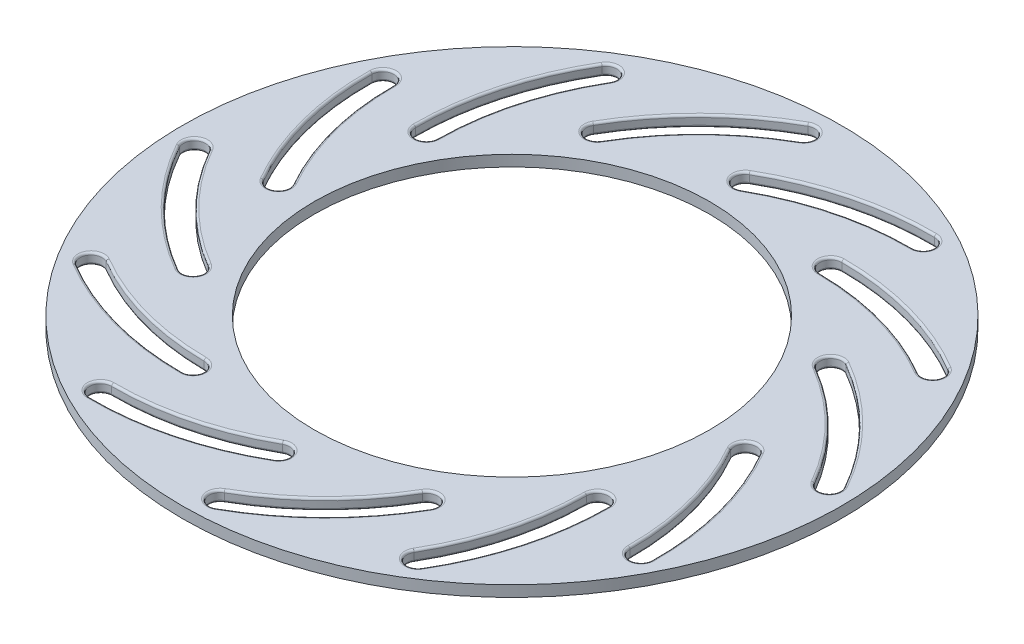
from build123d import *

# Parameters (mm, degrees)
SKETCH_01_R              = 60
SKETCH_01_R_2            = 36
TOP_RING_DEPTH           = 2
CUT_EXTRUDE1_DEPTH       = 85.876380696
FILLET1_R                = 0.4
CIRPATTERN1_COUNT        = 12
FILLET1_OF_CIRPATTERN1_R = 0.4


with BuildPart() as part:
    # sketch 01 → top ring (new body)
    with BuildSketch(Plane(origin=(0, 0, 0), x_dir=(1, 0, 0), z_dir=(0, 1, 0))):
        with Locations(Location((0, 0, 0), (0, 0, 270))):
            Circle(SKETCH_01_R)
        with Locations(Location((0, 0, 0), (0, 0, 270))):
            Circle(SKETCH_01_R_2, mode=Mode.SUBTRACT)
    extrude(amount=TOP_RING_DEPTH)

    # Sketch2 → Cut-Extrude1 (cut, through all)
    with BuildSketch(Plane(origin=(0, 2, 0), x_dir=(1, 0, 0), z_dir=(0, 1, 0))):
        with BuildLine():
            ThreePointArc((-1, 44.232050808), (11.890599802, 49.519139452), (25.722326885, 51.193712683))
            ThreePointArc((25.722326885, 51.193712683), (27.694418732, 49.171424871), (25.677365486, 47.193979435))
            ThreePointArc((25.677365486, 47.193979435), (12.908045968, 45.613674132), (0.990803619, 40.762672112))
            ThreePointArc((0.990803619, 40.762672112), (-1.734695442, 41.504594694), (-1, 44.232050808))
        make_face()
    cut_extrude1 = extrude(amount=-CUT_EXTRUDE1_DEPTH, mode=Mode.SUBTRACT)

    # Fillet1
    fillet1_edges = [part.edges().sort_by_distance(p)[0] for p in [
        (-1.734695442, 0, -41.504594694),
        (11.890599802, 2, -49.519139452),
        (27.694418732, 2, -49.171424871),
        (12.908045968, 0, -45.613674132),
        (11.890599802, 0, -49.519139452),
        (27.694418732, 0, -49.171424871),
        (-1.734695442, 2, -41.504594694),
        (12.908045968, 2, -45.613674132),
    ]]
    fillet(fillet1_edges, radius=FILLET1_R)

    # CirPattern1: Cut-Extrude1 ×12 about axis
    cirpattern1_axis = Axis((0, 0, 0), (0, 1, 0))
    for i in range(1, CIRPATTERN1_COUNT):
        add(cut_extrude1.rotate(cirpattern1_axis, i * 360 / CIRPATTERN1_COUNT), mode=Mode.SUBTRACT)

    # Fillet1 of CirPattern1
    fillet1_of_cirpattern1_edges = [part.edges().sort_by_distance(p)[0] for p in [
        (-22.254587667, 0, -35.076685658),
        (-14.462008231, 2, -48.83013264),
        (-0.601642271, 2, -56.430912444),
        (-11.628141345, 0, -45.956623542),
        (-14.462008231, 0, -48.83013264),
        (-0.601642271, 0, -56.430912444),
        (-22.254587667, 2, -35.076685658),
        (-11.628141345, 2, -45.956623542),
        (-36.811381099, 0, -19.250007026),
        (-36.939532838, 2, -35.057131221),
        (-28.736493713, 2, -48.5697826),
        (-33.048577574, 0, -33.985532787),
        (-36.939532838, 0, -35.057131221),
        (-28.736493713, 0, -48.5697826),
        (-36.811381099, 2, -19.250007026),
        (-33.048577574, 2, -33.985532787),
        (-41.504594694, 0, 1.734695442),
        (-49.519139452, 2, -11.890599802),
        (-49.171424871, 2, -27.694418732),
        (-45.613674132, 0, -12.908045968),
        (-49.519139452, 0, -11.890599802),
        (-49.171424871, 0, -27.694418732),
        (-41.504594694, 2, 1.734695442),
        (-45.613674132, 2, -12.908045968),
        (-35.076685658, 0, 22.254587667),
        (-48.83013264, 2, 14.462008231),
        (-56.430912444, 2, 0.601642271),
        (-45.956623542, 0, 11.628141345),
        (-48.83013264, 0, 14.462008231),
        (-56.430912444, 0, 0.601642271),
        (-35.076685658, 2, 22.254587667),
        (-45.956623542, 2, 11.628141345),
        (-19.250007026, 0, 36.811381099),
        (-35.057131221, 2, 36.939532838),
        (-48.5697826, 2, 28.736493713),
        (-33.985532787, 0, 33.048577574),
        (-35.057131221, 0, 36.939532838),
        (-48.5697826, 0, 28.736493713),
        (-19.250007026, 2, 36.811381099),
        (-33.985532787, 2, 33.048577574),
        (1.734695442, 0, 41.504594694),
        (-11.890599802, 2, 49.519139452),
        (-27.694418732, 2, 49.171424871),
        (-12.908045968, 0, 45.613674132),
        (-11.890599802, 0, 49.519139452),
        (-27.694418732, 0, 49.171424871),
        (1.734695442, 2, 41.504594694),
        (-12.908045968, 2, 45.613674132),
        (22.254587667, 0, 35.076685658),
        (14.462008231, 2, 48.83013264),
        (0.601642271, 2, 56.430912444),
        (11.628141345, 0, 45.956623542),
        (14.462008231, 0, 48.83013264),
        (0.601642271, 0, 56.430912444),
        (22.254587667, 2, 35.076685658),
        (11.628141345, 2, 45.956623542),
        (36.811381099, 0, 19.250007026),
        (36.939532838, 2, 35.057131221),
        (28.736493713, 2, 48.5697826),
        (33.048577574, 0, 33.985532787),
        (36.939532838, 0, 35.057131221),
        (28.736493713, 0, 48.5697826),
        (36.811381099, 2, 19.250007026),
        (33.048577574, 2, 33.985532787),
        (41.504594694, 0, -1.734695442),
        (49.519139452, 2, 11.890599802),
        (49.171424871, 2, 27.694418732),
        (45.613674132, 0, 12.908045968),
        (49.519139452, 0, 11.890599802),
        (49.171424871, 0, 27.694418732),
        (41.504594694, 2, -1.734695442),
        (45.613674132, 2, 12.908045968),
        (35.076685658, 0, -22.254587667),
        (48.83013264, 2, -14.462008231),
        (56.430912444, 2, -0.601642271),
        (45.956623542, 0, -11.628141345),
        (48.83013264, 0, -14.462008231),
        (56.430912444, 0, -0.601642271),
        (35.076685658, 2, -22.254587667),
        (45.956623542, 2, -11.628141345),
        (19.250007026, 0, -36.811381099),
        (35.057131221, 2, -36.939532838),
        (48.5697826, 2, -28.736493713),
        (33.985532787, 0, -33.048577574),
        (35.057131221, 0, -36.939532838),
        (48.5697826, 0, -28.736493713),
        (19.250007026, 2, -36.811381099),
        (33.985532787, 2, -33.048577574),
    ]]
    fillet(fillet1_of_cirpattern1_edges, radius=FILLET1_OF_CIRPATTERN1_R)


solid = part.part
